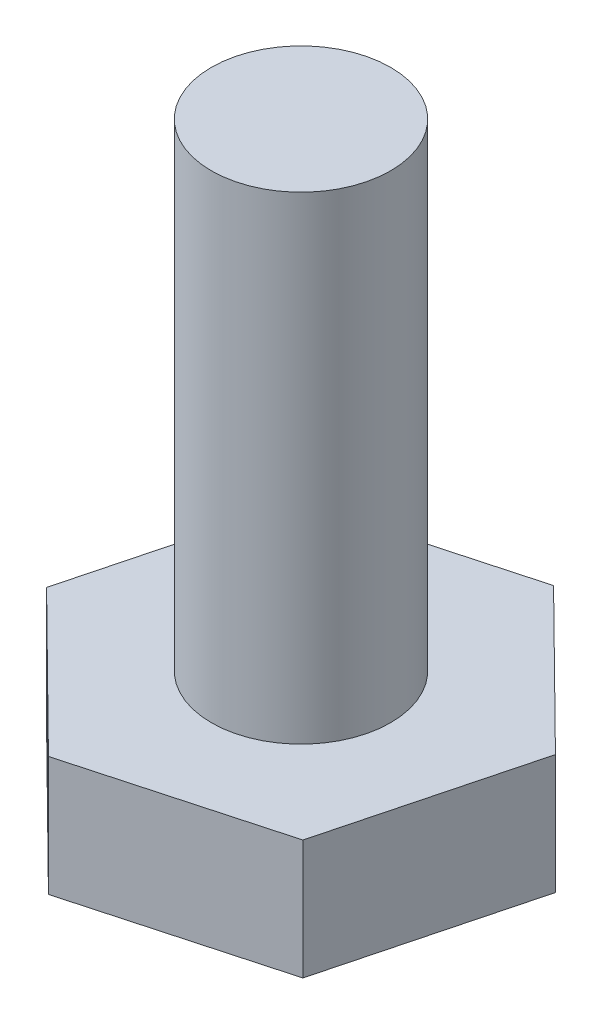
from build123d import *

# Parameters (mm, degrees)
BOSS_EXTRUDE1_DEPTH = 2
SKETCH2_R           = 1.5
BOSS_EXTRUDE2_DEPTH = 8


with BuildPart() as part:
    # Sketch1 → Boss-Extrude1 (new body)
    with BuildSketch(Plane(origin=(0, 0, 0), x_dir=(1, 0, 0), z_dir=(0, 1, 0))):
        Polygon((2.465199296, -2.433678786), (3.340227301, 0.918085822), (0.875028005, 3.351764608), (-2.465199296, 2.433678786), (-3.340227301, -0.918085822), (-0.875028005, -3.351764608), align=None)
    extrude(amount=BOSS_EXTRUDE1_DEPTH)

    # Sketch2 → Boss-Extrude2 (add)
    with BuildSketch(Plane(origin=(0, 2, 0), x_dir=(1, 0, 0), z_dir=(0, 1, 0))):
        Circle(SKETCH2_R)
    extrude(amount=BOSS_EXTRUDE2_DEPTH)


solid = part.part
